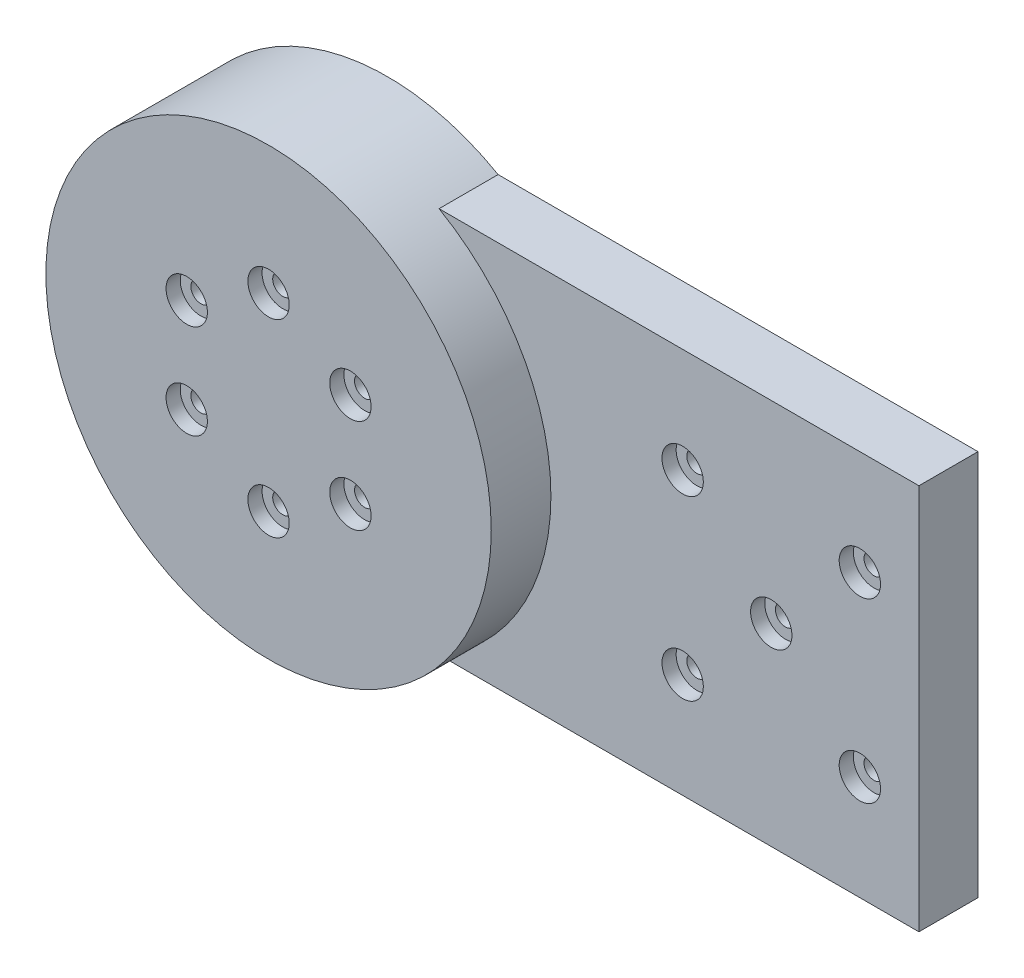
from build123d import *

# Parameters (mm, degrees)
CROQUIS1_R                                           = 37.7
SALIENTE_EXTRUIR1_DEPTH                              = 7
REFRENTADO_PARA_TORNILLO_CON_CABEZA_TRON_D           = 3.4
REFRENTADO_PARA_TORNILLO_CON_CABEZA_TRON_CBORE_D     = 7
REFRENTADO_PARA_TORNILLO_CON_CABEZA_TRON_CBORE_DEPTH = 2.4
SALIENTE_EXTRUIR2_START                              = 13.1
CROQUIS4_R                                           = 37.7
CROQUIS4_R_2                                         = 32.8
SALIENTE_EXTRUIR2_DEPTH                              = 13.1
SALIENTE_EXTRUIR3_DEPTH                              = 10
REFRENTADO_PARA_TORNILLO_CON_CABEZA_2_D              = 3.4
REFRENTADO_PARA_TORNILLO_CON_CABEZA_2_CBORE_D        = 7
REFRENTADO_PARA_TORNILLO_CON_CABEZA_2_CBORE_DEPTH    = 2.4


with BuildPart() as part:
    # Croquis1 → Saliente-Extruir1 (new body)
    with BuildSketch(Plane.XY):
        Circle(CROQUIS1_R)
    extrude(amount=SALIENTE_EXTRUIR1_DEPTH)

    # Refrentado para tornillo con cabeza tron (through all)
    with Locations(Plane.XY.offset(7)):
        with Locations((0, 16), (13.856406461, 8), (13.856406461, -8), (0, -16), (-13.856406461, -8), (-13.856406461, 8)):
            CounterBoreHole(REFRENTADO_PARA_TORNILLO_CON_CABEZA_TRON_D / 2, REFRENTADO_PARA_TORNILLO_CON_CABEZA_TRON_CBORE_D / 2, REFRENTADO_PARA_TORNILLO_CON_CABEZA_TRON_CBORE_DEPTH)

    # Croquis4 → Saliente-Extruir2 (add)
    with BuildSketch(Plane(origin=(0, 0, 0), x_dir=(-1, 0, 0), z_dir=(0, 0, -1)).offset(SALIENTE_EXTRUIR2_START)):
        Circle(CROQUIS4_R)
        Circle(CROQUIS4_R_2, mode=Mode.SUBTRACT)
    extrude(amount=-SALIENTE_EXTRUIR2_DEPTH)

    # Croquis5 → Saliente-Extruir3 (add)
    with BuildSketch(Plane(origin=(0, 0, -13.1), x_dir=(-1, 0, 0), z_dir=(0, 0, -1))):
        with BuildLine():
            Line((-18.761663039, 32.7), (-100, 32.7))
            Line((-100, 32.7), (-100, -32.7))
            Line((-100, -32.7), (-18.761663039, -32.7))
            ThreePointArc((-18.761663039, -32.7), (-37.7, 0), (-18.761663039, 32.7))
        make_face()
    extrude(amount=-SALIENTE_EXTRUIR3_DEPTH)

    # Refrentado para tornillo con cabeza  2 (through all)
    with Locations(Plane.XY.offset(-3.1)):
        with Locations((75, 0), (90, 15), (60, -15), (60, 15), (90, -15)):
            CounterBoreHole(REFRENTADO_PARA_TORNILLO_CON_CABEZA_2_D / 2, REFRENTADO_PARA_TORNILLO_CON_CABEZA_2_CBORE_D / 2, REFRENTADO_PARA_TORNILLO_CON_CABEZA_2_CBORE_DEPTH)


solid = part.part
